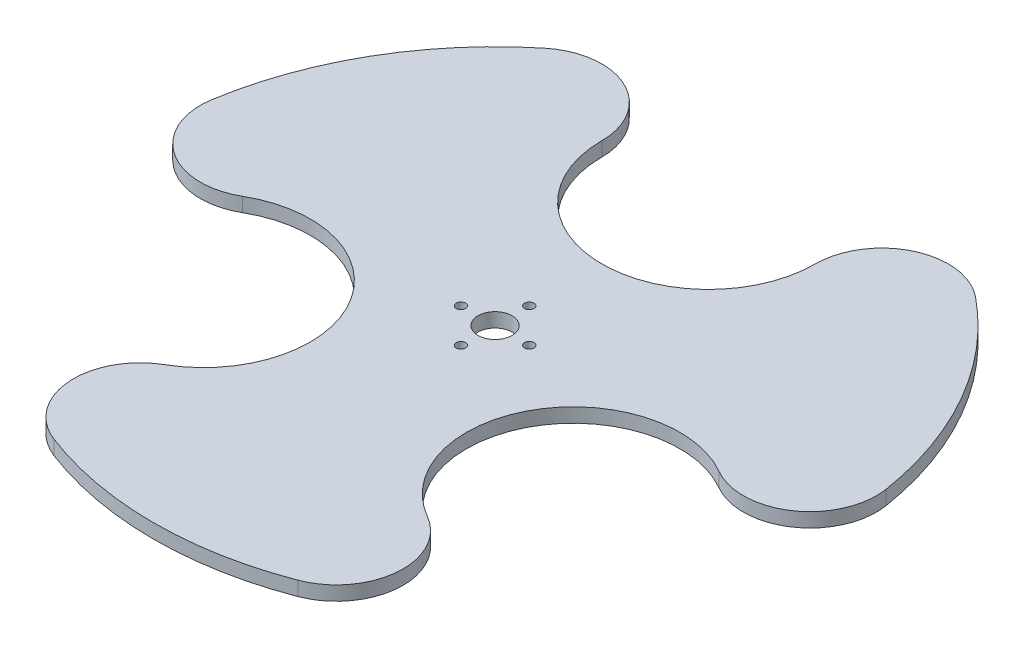
from build123d import *

# Parameters (mm, degrees)
SKETCH_1_R         = 6
EXTRUDE_1_DEPTH    = 5
HOLE_WIZARD_M4_1_D = 3.3


with BuildPart() as part:
    # 草圖1 → 填料-伸長1 (new body)
    with BuildSketch(Plane(origin=(0, 0, 0), x_dir=(1, 0, 0), z_dir=(0, 1, 0))):
        with BuildLine():
            ThreePointArc((-75.637707948, 93.160813309), (-103.923048454, 60), (-118.498484937, 18.923769913))
            ThreePointArc((-118.498484937, 18.923769913), (-108.660524842, -4.035424469), (-83.701905284, -5.024047358))
            ThreePointArc((-83.701905284, -5.024047358), (-32.475952642, -18.75), (-46.201905284, -69.975952642))
            ThreePointArc((-46.201905284, -69.975952642), (-57.825042527, -92.085062668), (-42.860776988, -112.084583222))
            ThreePointArc((-42.860776988, -112.084583222), (0, -120), (42.860776988, -112.084583222))
            ThreePointArc((42.860776988, -112.084583222), (57.825042527, -92.085062668), (46.201905284, -69.975952642))
            ThreePointArc((46.201905284, -69.975952642), (32.475952642, -18.75), (83.701905284, -5.024047358))
            ThreePointArc((83.701905284, -5.024047358), (108.660524842, -4.035424469), (118.498484937, 18.923769913))
            ThreePointArc((118.498484937, 18.923769913), (103.923048454, 60), (75.637707948, 93.160813309))
            ThreePointArc((75.637707948, 93.160813309), (50.835482316, 96.120487137), (37.5, 75))
            ThreePointArc((37.5, 75), (0, 37.5), (-37.5, 75))
            ThreePointArc((-37.5, 75), (-50.835482316, 96.120487137), (-75.637707948, 93.160813309))
        make_face()
        with Locations(Location((0, 0, 0), (0, 0, 270))):
            Circle(SKETCH_1_R, mode=Mode.SUBTRACT)
    extrude(amount=-EXTRUDE_1_DEPTH)

    # M4 螺紋孔1 (through all)
    with Locations(Plane(origin=(0, 0, 0), x_dir=(1, 0, 0), z_dir=(0, 1, 0))):
        with Locations((0, 12), (12, 0), (0, -12), (-12, 0)):
            Hole(HOLE_WIZARD_M4_1_D / 2)


solid = part.part
